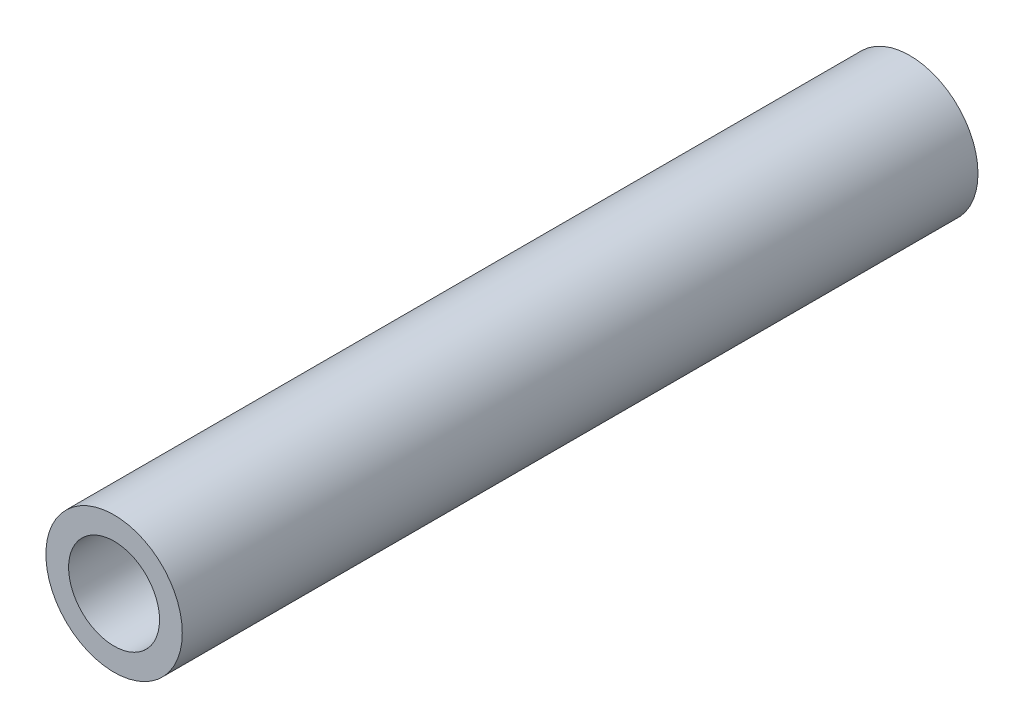
from build123d import *

# Parameters (mm, degrees)
SCHIZZO1_R                   = 3
SCHIZZO1_R_2                 = 2
ESTRUSIONE_ESTRUSIONE1_DEPTH = 35


with BuildPart() as part:
    # Schizzo1 → Estrusione-Estrusione1 (new body)
    with BuildSketch(Plane.XY):
        with Locations((215, -26.42393853)):
            Circle(SCHIZZO1_R)
        with Locations((215, -26.42393853)):
            Circle(SCHIZZO1_R_2, mode=Mode.SUBTRACT)
    extrude(amount=ESTRUSIONE_ESTRUSIONE1_DEPTH)


solid = part.part
